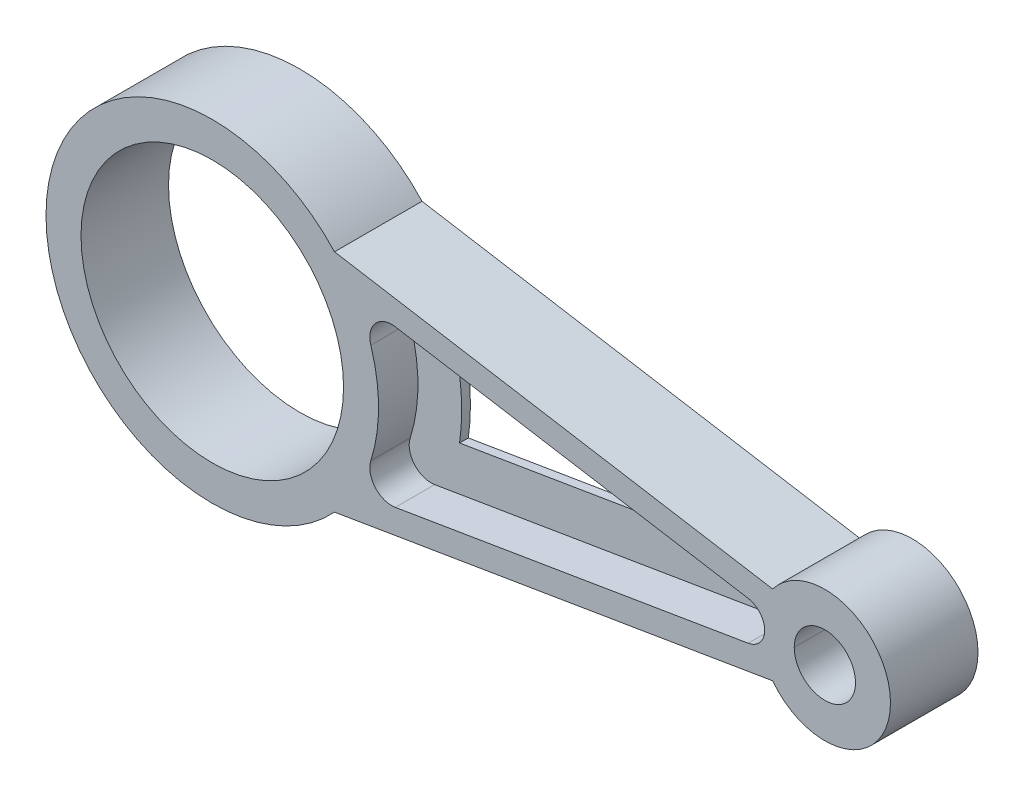
from build123d import *

# Parameters (mm, degrees)
SKETCH1_R           = 30
SKETCH1_R_2         = 7
BOSS_EXTRUDE1_DEPTH = 10
CUT_EXTRUDE1_DEPTH  = 9
CUT_EXTRUDE2_DEPTH  = 160.968746948


with BuildPart() as part:
    # Sketch1 → Boss-Extrude1 (new, symmetric)
    with BuildSketch(Plane.XY):
        with BuildLine():
            Line((27.935473676, 25.760615491), (128.063755469, 9.084385863))
            ThreePointArc((128.063755469, 9.084385863), (155, 0), (128.063755469, -9.084385863))
            Line((128.063755469, -9.084385863), (27.935473676, -25.760615491))
            ThreePointArc((27.935473676, -25.760615491), (-38, 0), (27.935473676, 25.760615491))
        make_face()
        Circle(SKETCH1_R, mode=Mode.SUBTRACT)
        with Locations((140, 0)):
            Circle(SKETCH1_R_2, mode=Mode.SUBTRACT)
    extrude(amount=BOSS_EXTRUDE1_DEPTH, both=True)

    # Sketch2 → Cut-Extrude1 (cut)
    with BuildSketch(Plane.XY.offset(10)):
        with BuildLine():
            Line((41.828554558, 17.870982725), (122.478416149, 4.438857582))
            ThreePointArc((122.478416149, 4.438857582), (126.239130435, 0), (122.478416149, -4.438857582))
            Line((122.478416149, -4.438857582), (41.828554558, -17.870982725))
            ThreePointArc((41.828554558, -17.870982725), (37.231968897, -16.217361812), (36.238855523, -11.43439331))
            ThreePointArc((36.238855523, -11.43439331), (38, 0), (36.238855523, 11.43439331))
            ThreePointArc((36.238855523, 11.43439331), (37.231968897, 16.217361812), (41.828554558, 17.870982725))
        make_face()
    cut_extrude1 = extrude(amount=-CUT_EXTRUDE1_DEPTH, mode=Mode.SUBTRACT)

    # Mirror1: Cut-Extrude1 across plane
    add(cut_extrude1.mirror(Plane.XY), mode=Mode.SUBTRACT)

    # Sketch3 → Cut-Extrude2 (cut, through all)
    with BuildSketch(Plane.XY.offset(1)):
        with BuildLine():
            ThreePointArc((47.517939236, -6.785679827), (48, 0), (47.517939236, 6.785679827))
            Line((47.517939236, 6.785679827), (88.260869565, 0))
            Line((88.260869565, 0), (47.517939236, -6.785679827))
        make_face()
    extrude(amount=-CUT_EXTRUDE2_DEPTH, mode=Mode.SUBTRACT)


solid = part.part
